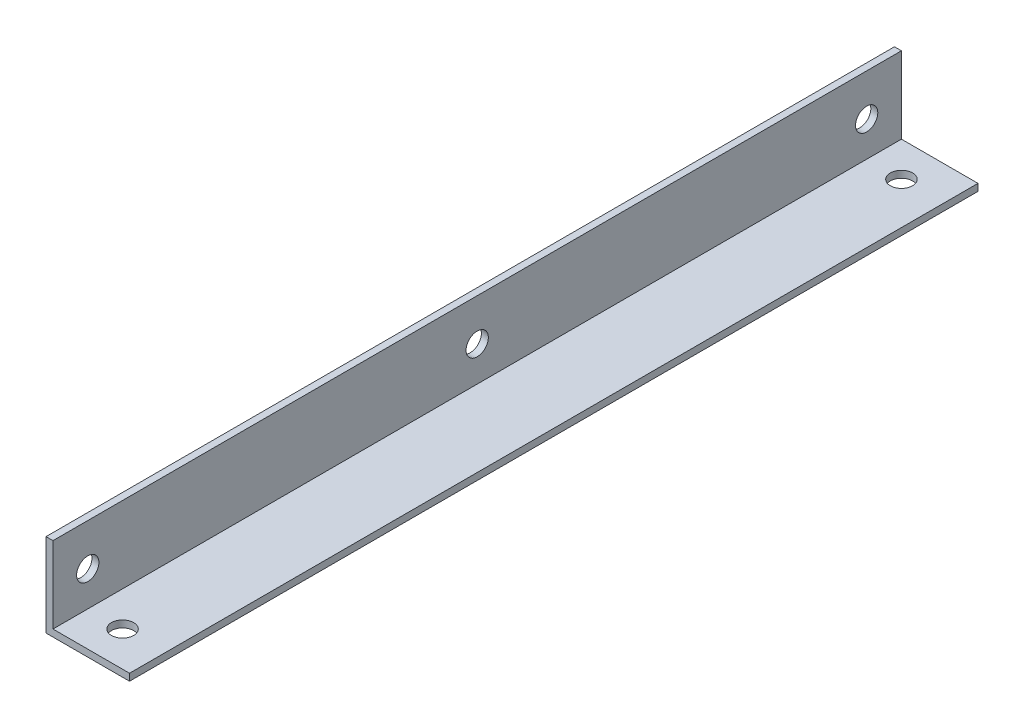
from build123d import *

# Parameters (mm, degrees)
BOSS_EXTRUDE1_DEPTH = 304.8
SKETCH2_R           = 4
CUT_EXTRUDE1_DEPTH  = 308.50494305
SKETCH3_R           = 4
CUT_EXTRUDE2_DEPTH  = 308.50494305
SKETCH5_R           = 4
CUT_EXTRUDE3_DEPTH  = 308.50494305


with BuildPart() as part:
    # Sketch1 → Boss-Extrude1 (new body)
    with BuildSketch(Plane.XY):
        Polygon((0, 0), (0, 30), (2.5, 30), (2.5, 2.5), (30, 2.5), (30, 0), align=None)
    extrude(amount=BOSS_EXTRUDE1_DEPTH)

    # Sketch2 → Cut-Extrude1 (cut, through all)
    with BuildSketch(Plane(origin=(0, 2.5, 0), x_dir=(1, 0, 0), z_dir=(0, 1, 0))):
        with Locations(Location((15, -12.5, 0), (0, 0, 180))):
            Circle(SKETCH2_R)
        with Locations((15, -292.3)):
            Circle(SKETCH2_R)
    extrude(amount=-CUT_EXTRUDE1_DEPTH, mode=Mode.SUBTRACT)

    # Sketch3 → Cut-Extrude2 (cut, through all)
    with BuildSketch(Plane(origin=(2.5, 0, 0), x_dir=(0, 0, -1), z_dir=(1, 0, 0))):
        with Locations(Location((-12.5, 15, 0), (0, 0, 90))):
            Circle(SKETCH3_R)
        with Locations(Location((-292.3, 15, 0), (0, 0, 270))):
            Circle(SKETCH3_R)
    extrude(amount=-CUT_EXTRUDE2_DEPTH, mode=Mode.SUBTRACT)

    # Sketch5 → Cut-Extrude3 (cut, through all)
    with BuildSketch(Plane(origin=(2.5, 0, 0), x_dir=(0, 0, -1), z_dir=(1, 0, 0))):
        with Locations(Location((-152.4, 15, 0), (0, 0, 90))):
            Circle(SKETCH5_R)
    extrude(amount=-CUT_EXTRUDE3_DEPTH, mode=Mode.SUBTRACT)


solid = part.part
